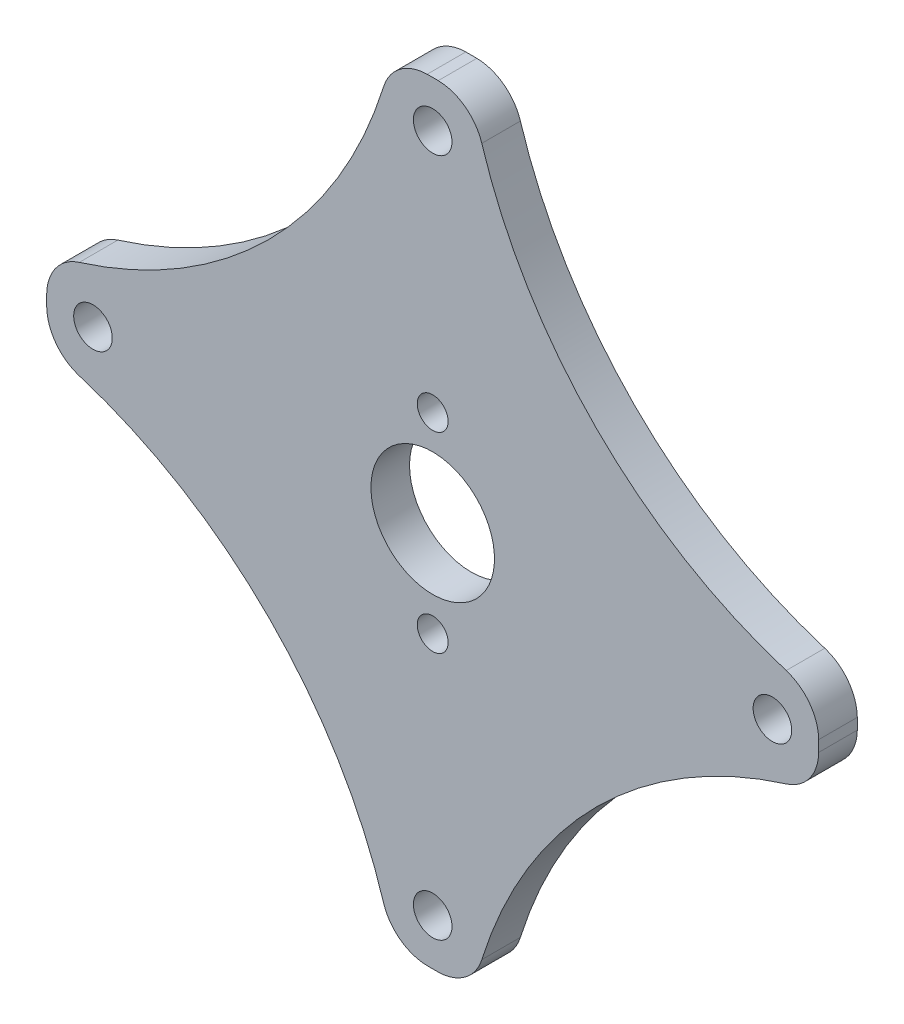
from build123d import *

# Parameters (mm, degrees)
SKETCH_1_R               = 25
SKETCH_1_R_2             = 1.25
EXTRUDE_1_DEPTH          = 2.5
CUT_EXTRUDE_2_DEPTH      = 36.443617197
CUT_EXTRUDE_2_DEPTH_BACK = 36.443617197
SKETCH_3_R               = 1
SKETCH_3_R_2             = 4
CUT_EXTRUDE_5_DEPTH      = 10
FILLET_2_R               = 3


with BuildPart() as part:
    # 草图1 → 凸台-拉伸1 (new body)
    with BuildSketch(Plane.XY):
        Circle(SKETCH_1_R)
        with Locations((0, 22)):
            Circle(SKETCH_1_R_2, mode=Mode.SUBTRACT)
        with Locations((22, 0)):
            Circle(SKETCH_1_R_2, mode=Mode.SUBTRACT)
        with Locations((0, -22)):
            Circle(SKETCH_1_R_2, mode=Mode.SUBTRACT)
        with Locations(Location((-22, 0, 0), (0, 0, 180))):
            Circle(SKETCH_1_R_2, mode=Mode.SUBTRACT)
    extrude(amount=EXTRUDE_1_DEPTH)

    # 草图3 → 切除-拉伸2 (cut, two sides: drawn at the far end of the back side and taken through both)
    with BuildSketch(Plane(origin=(0, 0, 0), x_dir=(-1, 0, 0), z_dir=(0, 0, -1)).offset(-CUT_EXTRUDE_2_DEPTH_BACK)):
        with Locations((0, 6.2)):
            Circle(SKETCH_3_R)
        Circle(SKETCH_3_R_2)
        with Locations((0, -6.2)):
            Circle(SKETCH_3_R)
    extrude(amount=CUT_EXTRUDE_2_DEPTH + CUT_EXTRUDE_2_DEPTH_BACK, mode=Mode.SUBTRACT)

    # 草图5 → 切除-拉伸5 (cut)
    with BuildSketch(Plane(origin=(0, 0, 0), x_dir=(-1, 0, 0), z_dir=(0, 0, -1))):
        with BuildLine():
            ThreePointArc((-2.638187412, 24.860409634), (-17.67766953, 17.67766953), (-24.860409634, 2.638187412))
            ThreePointArc((-24.860409634, 2.638187412), (-10.606601718, 10.606601718), (-2.638187412, 24.860409634))
        make_face()
        with BuildLine():
            ThreePointArc((-2.638187412, -24.860409634), (-10.606601718, -10.606601718), (-24.860409634, -2.638187412))
            ThreePointArc((-24.860409634, -2.638187412), (-17.67766953, -17.67766953), (-2.638187412, -24.860409634))
        make_face()
        with BuildLine():
            ThreePointArc((24.860409634, -2.638187412), (10.606601718, -10.606601718), (2.638187412, -24.860409634))
            ThreePointArc((2.638187412, -24.860409634), (17.67766953, -17.67766953), (24.860409634, -2.638187412))
        make_face()
        with BuildLine():
            ThreePointArc((24.860409634, 2.638187412), (17.67766953, 17.67766953), (2.638187412, 24.860409634))
            ThreePointArc((2.638187412, 24.860409634), (10.606601718, 10.606601718), (24.860409634, 2.638187412))
        make_face()
    extrude(amount=-CUT_EXTRUDE_5_DEPTH, mode=Mode.SUBTRACT)

    # 圆角2
    fillet_2_edges = [part.edges().sort_by_distance(p)[0] for p in [
        (2.638187412, 24.860409634, 1.25),
        (24.860409634, 2.638187412, 1.25),
        (24.860409634, -2.638187412, 1.25),
        (2.638187412, -24.860409634, 1.25),
        (-2.638187412, -24.860409634, 1.25),
        (-24.860409634, -2.638187412, 1.25),
        (-24.860409634, 2.638187412, 1.25),
        (-2.638187412, 24.860409634, 1.25),
    ]]
    fillet(fillet_2_edges, radius=FILLET_2_R)


solid = part.part
